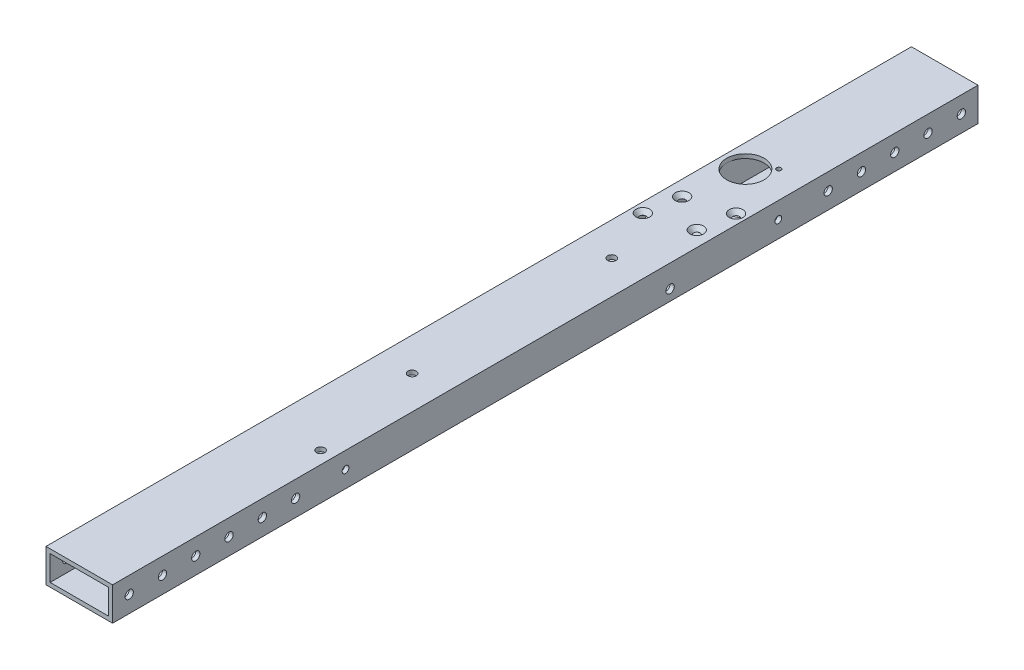
from build123d import *

# Parameters (mm, degrees)
BOSS_EXTRUDE1_DEPTH              = 330.200001
BOSS_EXTRUDE1_DEPTH_BACK         = 330.200001
SKETCH3_W                        = 50.8
SKETCH3_H                        = 25.4
SKETCH3_W_2                      = 44.45
SKETCH3_H_2                      = 19.05
F_1_4_0_25_DIAMETER_HOLE3_D      = 6.35
F_1_4_0_25_DIAMETER_HOLE4_D      = 6.35
F_1_4_0_25_DIAMETER_HOLE5_D      = 6.35
F_1_4_0_25_DIAMETER_HOLE6_D      = 6.35
F_1_4_0_25_DIAMETER_HOLE7_D      = 6.35
F_1_4_0_25_DIAMETER_HOLE8_D      = 6.35
F_13_64_0_20313_DIAMETER_HOLE1_D = 5.159502
F_1_2_0_5_DIAMETER_HOLE1_D       = 12.7
F_1_2_0_5_DIAMETER_HOLE1_DEPTH   = 6.35
F_1_2_0_5_DIAMETER_HOLE1_TIP     = 3.815464931
F_10_CLEARANCE_HOLE1_AT_2_COUNT  = 2
F_10_CLEARANCE_HOLE1_AT_2_PITCH  = 26.179508771
F_10_CLEARANCE_HOLE1_AT_3_COUNT  = 2
F_10_CLEARANCE_HOLE1_AT_3_PITCH  = 32.162957462
F_10_CLEARANCE_HOLE1_AT_4_COUNT  = 2
F_10_CLEARANCE_HOLE1_AT_4_PITCH  = 33.11362798
SKETCH35_R                       = 14.2875
CUT_EXTRUDE1_DEPTH               = 333.148100492
TAP_DRILL_FOR_8_32_TAP1_D        = 3.4544
F_1_4_0_25_DIAMETER_HOLE9_D      = 6.35
F_1_4_0_25_DIAMETER_HOLE10_D     = 6.35
F_1_4_0_25_DIAMETER_HOLE10_DEPTH = 5.08
F_1_4_0_25_DIAMETER_HOLE10_TIP   = 1.907732465


with BuildPart() as part:
    # Sketch3 → Boss-Extrude1 (new, two sides: drawn at the far end of the back side and taken through both)
    with BuildSketch(Plane.XY.offset(-BOSS_EXTRUDE1_DEPTH_BACK)):
        Rectangle(SKETCH3_W, SKETCH3_H)
        Rectangle(SKETCH3_W_2, SKETCH3_H_2, mode=Mode.SUBTRACT)
    extrude(amount=BOSS_EXTRUDE1_DEPTH + BOSS_EXTRUDE1_DEPTH_BACK)

    # 1/4 (0.25) Diameter Hole3 (through all)
    with Locations(Plane.ZY.offset(25.4)):
        with Locations((-317.500000508, 0)):
            Hole(F_1_4_0_25_DIAMETER_HOLE3_D / 2)

    # 1/4 (0.25) Diameter Hole4 (through all)
    with Locations(Plane.ZY.offset(25.4)):
        with Locations((292.100000508, 0), (317.500000508, 0)):
            Hole(F_1_4_0_25_DIAMETER_HOLE4_D / 2)

    # 1/4 (0.25) Diameter Hole5 (through all)
    with Locations(Plane(origin=(25.4, 0, 0), x_dir=(0, 0, -1), z_dir=(1, 0, 0))):
        with Locations((292.100000508, 0), (266.700000508, 0)):
            Hole(F_1_4_0_25_DIAMETER_HOLE5_D / 2)

    # 1/4 (0.25) Diameter Hole6 (through all)
    with Locations(Plane(origin=(25.4, 0, 0), x_dir=(0, 0, -1), z_dir=(1, 0, 0))):
        with Locations((215.900000508, 0), (241.300000508, 0)):
            Hole(F_1_4_0_25_DIAMETER_HOLE6_D / 2)

    # 1/4 (0.25) Diameter Hole7 (through all)
    with Locations(Plane(origin=(25.4, 0, 0), x_dir=(0, 0, -1), z_dir=(1, 0, 0))):
        with Locations((-190.5, 0), (-215.9, 0)):
            Hole(F_1_4_0_25_DIAMETER_HOLE7_D / 2)

    # 1/4 (0.25) Diameter Hole8 (through all)
    with Locations(Plane(origin=(25.4, 0, 0), x_dir=(0, 0, -1), z_dir=(1, 0, 0))):
        with Locations((-266.7, 0), (-241.3, 0)):
            Hole(F_1_4_0_25_DIAMETER_HOLE8_D / 2)

    # 13/64 (0.20313) Diameter Hole1 (through all)
    with Locations(Plane(origin=(25.4, 0, 0), x_dir=(0, 0, -1), z_dir=(1, 0, 0))):
        with Locations((-152.4, 0), (177.8, 0)):
            Hole(F_13_64_0_20313_DIAMETER_HOLE1_D / 2)

    # 1/2 (0.5) Diameter Hole1
    with Locations(Plane.ZY.offset(25.4)):
        with Locations((-591.301639708, -480.802221962), (-103.1875, 0), (77.7875, 0), (103.1875, 0), (-128.5875, 0)):
            Hole(F_1_2_0_5_DIAMETER_HOLE1_D / 2, depth=F_1_2_0_5_DIAMETER_HOLE1_DEPTH)
            with Locations((0, 0, -(F_1_2_0_5_DIAMETER_HOLE1_DEPTH + F_1_2_0_5_DIAMETER_HOLE1_TIP / 2))):  # 118° drill point
                Cone(0, F_1_2_0_5_DIAMETER_HOLE1_D / 2, F_1_2_0_5_DIAMETER_HOLE1_TIP, mode=Mode.SUBTRACT)

    # Sketch34 → #10 Clearance Hole1 (revolve, cut)
    with BuildSketch(Plane(origin=(-13.81901292, -12.7, -143.631885069), x_dir=(0, 0, -1), z_dir=(1, 0, 0))):
        Polygon((0, 0), (0, 25.4), (5.2197, 25.4), (2.4892, 22.258919064), (2.4892, 0), align=None)
    f_10_clearance_hole1 = revolve(axis=Axis((-13.81901292, -19.05, -143.631885069), (0, 1, 0)), mode=Mode.SUBTRACT)

    # #10 Clearance Hole1 at 2: #10 Clearance Hole1 ×2
    with Locations(*[Vector(-0.15706842311694033, 0, 0.9875877229186063) * (i * F_10_CLEARANCE_HOLE1_AT_2_PITCH) for i in range(1, F_10_CLEARANCE_HOLE1_AT_2_COUNT)]):
        add(f_10_clearance_hole1, mode=Mode.SUBTRACT)

    # #10 Clearance Hole1 at 3: #10 Clearance Hole1 ×2
    with Locations(*[Vector(0.8593123276123446, 0, 0.5114511937745914) * (i * F_10_CLEARANCE_HOLE1_AT_3_PITCH) for i in range(1, F_10_CLEARANCE_HOLE1_AT_3_COUNT)]):
        add(f_10_clearance_hole1, mode=Mode.SUBTRACT)

    # #10 Clearance Hole1 at 4: #10 Clearance Hole1 ×2
    with Locations(*[Vector(0.9588197348681927, 0, -0.28401534470392387) * (i * F_10_CLEARANCE_HOLE1_AT_4_PITCH) for i in range(1, F_10_CLEARANCE_HOLE1_AT_4_COUNT)]):
        add(f_10_clearance_hole1, mode=Mode.SUBTRACT)

    # Sketch35 → Cut-Extrude1 (cut, through all)
    with BuildSketch(Plane.XZ.offset(12.7)):
        with Locations((-7.9375, -186.037603725)):
            Circle(SKETCH35_R)
    extrude(amount=-CUT_EXTRUDE1_DEPTH, mode=Mode.SUBTRACT)

    # Tap Drill for #8-32 Tap1 (through all)
    with Locations(Plane(origin=(0, -12.7, 0), x_dir=(-1, 0, 0), z_dir=(0, -1, 0))):
        with Locations((-4.814463692, 198.789567417)):
            Hole(TAP_DRILL_FOR_8_32_TAP1_D / 2)

    # 1/4 (0.25) Diameter Hole9 (through all)
    with Locations(Plane(origin=(0, -12.7, 0), x_dir=(-1, 0, 0), z_dir=(0, -1, 0))):
        with Locations((-15.875, -161.925), (0, -76.2), (0, 76.2)):
            Hole(F_1_4_0_25_DIAMETER_HOLE9_D / 2)

    # 1/4 (0.25) Diameter Hole10
    with Locations(Plane(origin=(25.4, 0, 0), x_dir=(0, 0, -1), z_dir=(1, 0, 0))):
        with Locations((95.25, -4.45)):
            Hole(F_1_4_0_25_DIAMETER_HOLE10_D / 2, depth=F_1_4_0_25_DIAMETER_HOLE10_DEPTH)
            with Locations((0, 0, -(F_1_4_0_25_DIAMETER_HOLE10_DEPTH + F_1_4_0_25_DIAMETER_HOLE10_TIP / 2))):  # 118° drill point
                Cone(0, F_1_4_0_25_DIAMETER_HOLE10_D / 2, F_1_4_0_25_DIAMETER_HOLE10_TIP, mode=Mode.SUBTRACT)


solid = part.part
